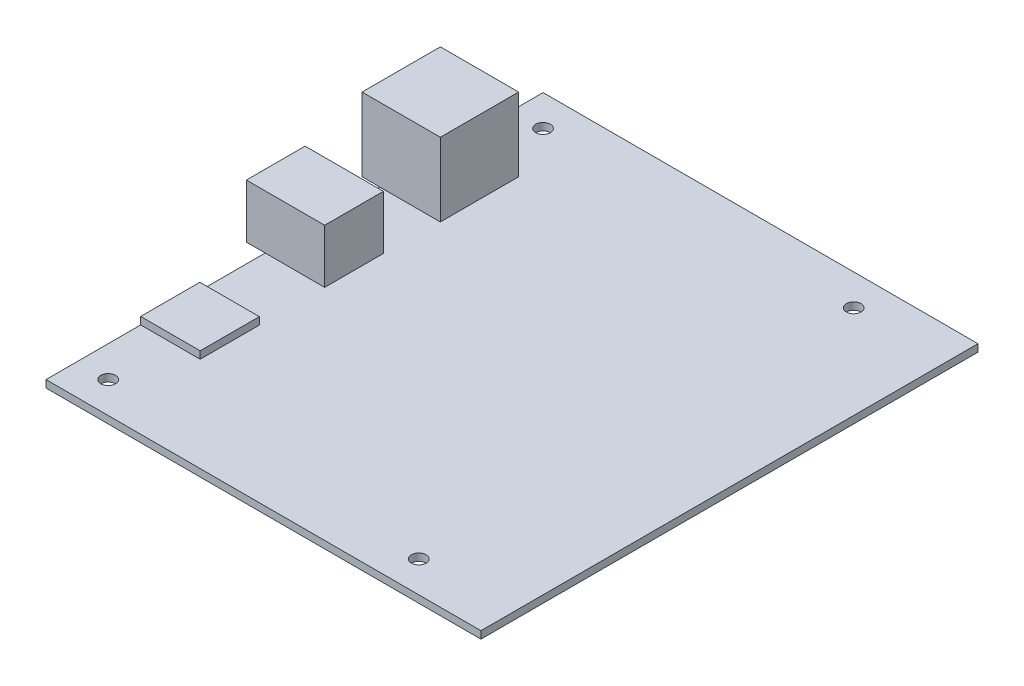
from build123d import *

# Parameters (mm, degrees)
SKETCH1_W           = 88.9
SKETCH1_H           = 101.6
SKETCH1_R           = 1.5
BOSS_EXTRUDE1_DEPTH = 1.5
SKETCH3_W           = 16
SKETCH3_H           = 16
BOSS_EXTRUDE2_DEPTH = 15
SKETCH3_3_W         = 16
SKETCH3_3_H         = 12
BOSS_EXTRUDE3_DEPTH = 11
SKETCH3_4_W         = 12.16
SKETCH3_4_H         = 12.1
BOSS_EXTRUDE4_DEPTH = 1.5


with BuildPart() as part:
    # Sketch1 → Boss-Extrude1 (new body)
    with BuildSketch(Plane(origin=(0, 0, 0), x_dir=(1, 0, 0), z_dir=(0, 1, 0))):
        Rectangle(SKETCH1_W, SKETCH1_H)
        with Locations((-38.1, -44.45)):
            Circle(SKETCH1_R, mode=Mode.SUBTRACT)
        with Locations((25.4, -44.45)):
            Circle(SKETCH1_R, mode=Mode.SUBTRACT)
        with Locations((-38.1, 44.45)):
            Circle(SKETCH1_R, mode=Mode.SUBTRACT)
        with Locations((25.4, 44.45)):
            Circle(SKETCH1_R, mode=Mode.SUBTRACT)
    extrude(amount=BOSS_EXTRUDE1_DEPTH)

    # Sketch3 → Boss-Extrude2 (add)
    with BuildSketch(Plane(origin=(0, 1.5, 0), x_dir=(1, 0, 0), z_dir=(0, 1, 0))):
        with Locations((-40.044, 25.4)):
            Rectangle(SKETCH3_W, SKETCH3_H)
    extrude(amount=BOSS_EXTRUDE2_DEPTH)

    # Sketch3<3> → Boss-Extrude3 (add)
    with BuildSketch(Plane(origin=(0, 1.5, 0), x_dir=(1, 0, 0), z_dir=(0, 1, 0))):
        with Locations((-40.29, 0)):
            Rectangle(SKETCH3_3_W, SKETCH3_3_H)
    extrude(amount=BOSS_EXTRUDE3_DEPTH)

    # Sketch3<4> → Boss-Extrude4 (add)
    with BuildSketch(Plane(origin=(0, 1.5, 0), x_dir=(1, 0, 0), z_dir=(0, 1, 0))):
        with Locations((-38.37, -25.4)):
            Rectangle(SKETCH3_4_W, SKETCH3_4_H)
    extrude(amount=BOSS_EXTRUDE4_DEPTH)


solid = part.part
